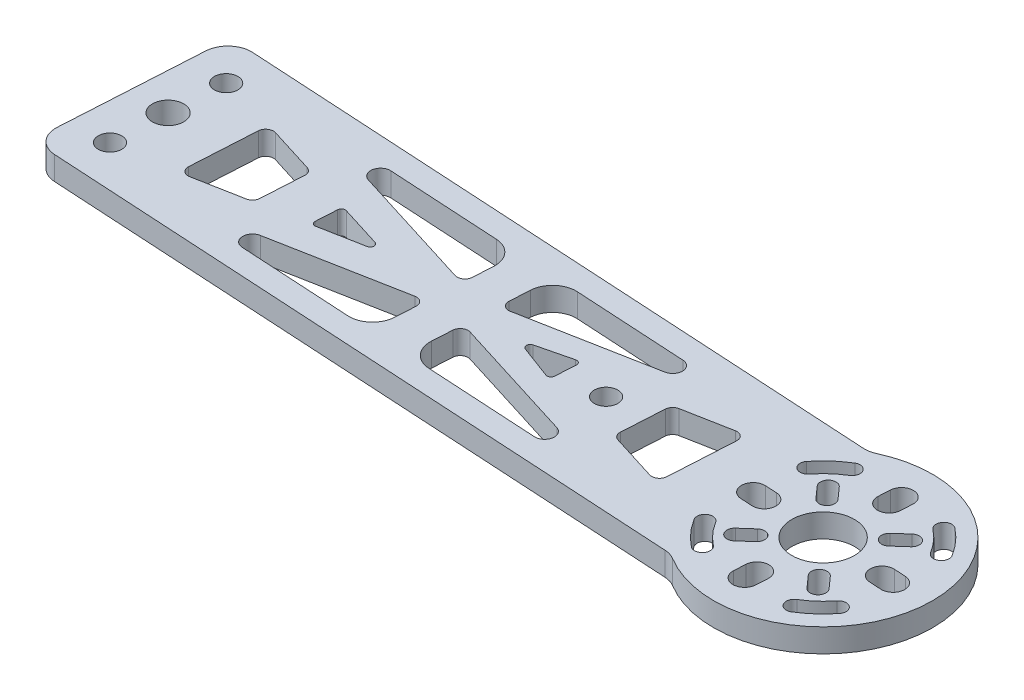
from build123d import *

# Parameters (mm, degrees)
SKETCH1_R           = 1.5
SKETCH1_R_2         = 4
SKETCH1_R_3         = 2
BOSS_EXTRUDE1_DEPTH = 3
SKETCH2_R           = 1.5
CUT_EXTRUDE2_DEPTH  = 3
FILLET1_R           = 1
FILLET2_R           = 1.25
FILLET3_R           = 3
FILLET4_R           = 1
FILLET5_R           = 0.5
FILLET6_R           = 3


with BuildPart() as part:
    # Sketch1 → Boss-Extrude1 (new body)
    with BuildSketch(Plane(origin=(0, 0, 0), x_dir=(1, 0, 0), z_dir=(0, 1, 0))):
        with BuildLine():
            Line((23.065289305, 10.113813665), (21.67993882, -13.846169724))
            Line((21.67993882, -13.846169724), (108.324128041, -18.855879772))
            ThreePointArc((108.324128041, -18.855879772), (130.192539316, -8.10025521), (109.709478525, 5.104103618))
            Line((109.709478525, 5.104103618), (23.065289305, 10.113813665))
        make_face()
        with Locations(Location((26.914085012, -9.154397921, 0), (0, 0, 270))):
            Circle(SKETCH1_R, mode=Mode.SUBTRACT)
        with Locations(Location((27.769141375, 4.847433338, 0), (0, 0, 270))):
            Circle(SKETCH1_R, mode=Mode.SUBTRACT)
        with Locations(Location((116.215882339, -7.292134094, 0), (0, 0, 270))):
            Circle(SKETCH1_R_2, mode=Mode.SUBTRACT)
        with Locations(Location((27.341613193, -2.153482292, 0), (0, 0, 270))):
            Circle(SKETCH1_R_3, mode=Mode.SUBTRACT)
    extrude(amount=BOSS_EXTRUDE1_DEPTH)

    # Sketch2 → Cut-Extrude2 (cut)
    with BuildSketch(Plane(origin=(0, 0, 0), x_dir=(1, 0, 0), z_dir=(0, 1, 0))):
        with Locations(Location((86.765069423, -5.589307457, 0), (0, 0, 270))):
            Circle(SKETCH2_R)
        Polygon((35.169248231, 2.903114787), (34.534295925, -8.078544267), (42.636402929, -6.543662479), (43.040463487, 0.444666009), align=None)
        Polygon((48.712983182, -5.392501139), (48.943874929, -1.399170574), (56.815090185, -3.857619351), align=None)
        Polygon((37.85954525, 6.253409084), (64.924303207, -2.199837199), (65.321257747, 4.665590925), align=None)
        Polygon((36.820532386, -11.716578458), (64.679199423, -6.438968493), (64.282244884, -13.304396617), align=None)
        Polygon((69.27390809, -13.593011301), (96.735620587, -15.180829461), (69.670862629, -6.727583177), align=None)
        Polygon((97.77463345, 2.789158082), (69.915966413, -2.488451884), (70.312920953, 4.376976241), align=None)
        Polygon((81.158794022, -7.268496587), (74.785077728, -4.896632215), (81.389685769, -3.275166022), align=None)
        Polygon((100.060869911, -0.848876109), (99.425917606, -11.830535163), (91.55470235, -9.372086386), (91.958762908, -2.383757897), align=None)
        with BuildLine():
            Line((120.953295402, -11.107486957), (122.283518403, -12.600975079))
            ThreePointArc((122.283518403, -12.600975079), (122.201885843, -14.01283064), (120.790030282, -13.931198079))
            Line((120.790030282, -13.931198079), (119.459807281, -12.437709958))
            ThreePointArc((119.459807281, -12.437709958), (119.541439841, -11.025854397), (120.953295402, -11.107486957))
        make_face()
        with BuildLine():
            Line((114.170015477, -16.689709781), (114.256599882, -15.192210819))
            ThreePointArc((114.256599882, -15.192210819), (115.840683249, -13.781296262), (117.251597806, -15.36537963))
            Line((117.251597806, -15.36537963), (117.165013401, -16.862878591))
            ThreePointArc((117.165013401, -16.862878591), (115.580930034, -18.273793148), (114.170015477, -16.689709781))
        make_face()
        with BuildLine():
            Line((121.361458203, -4.048209152), (122.854946324, -2.717986152))
            ThreePointArc((122.854946324, -2.717986152), (122.936578884, -1.306130591), (121.524723323, -1.22449803))
            Line((121.524723323, -1.22449803), (120.031235202, -2.554721031))
            ThreePointArc((120.031235202, -2.554721031), (119.949602642, -3.966576592), (121.361458203, -4.048209152))
        make_face()
        with BuildLine():
            Line((115.266751277, 2.278610403), (115.180166872, 0.781111441))
            ThreePointArc((115.180166872, 0.781111441), (116.591081429, -0.802971926), (118.175164796, 0.60794263))
            Line((118.175164796, 0.60794263), (118.261749201, 2.105441592))
            ThreePointArc((118.261749201, 2.105441592), (116.850834644, 3.689524959), (115.266751277, 2.278610403))
        make_face()
        with BuildLine():
            Line((112.971957397, -2.14655823), (111.641734396, -0.653070109))
            ThreePointArc((111.641734396, -0.653070109), (110.229878835, -0.571437549), (110.148246275, -1.98329311))
            Line((110.148246275, -1.98329311), (111.478469276, -3.476781231))
            ThreePointArc((111.478469276, -3.476781231), (112.890324837, -3.558413791), (112.971957397, -2.14655823))
        make_face()
        with BuildLine():
            Line((112.400529476, -12.029547157), (110.907041355, -13.359770158))
            ThreePointArc((110.907041355, -13.359770158), (109.495185794, -13.278137598), (109.576818354, -11.866282037))
            Line((109.576818354, -11.866282037), (111.070306475, -10.536059036))
            ThreePointArc((111.070306475, -10.536059036), (112.482162036, -10.617691596), (112.400529476, -12.029547157))
        make_face()
        with BuildLine():
            Line((125.786626836, -6.343003033), (124.289127874, -6.256418627))
            ThreePointArc((124.289127874, -6.256418627), (122.705044507, -7.667333184), (124.115959064, -9.251416551))
            Line((124.115959064, -9.251416551), (125.613458025, -9.338000956))
            ThreePointArc((125.613458025, -9.338000956), (127.197541393, -7.9270864), (125.786626836, -6.343003033))
        make_face()
        with BuildLine():
            Line((106.818306653, -5.246267232), (108.315805614, -5.332851638))
            ThreePointArc((108.315805614, -5.332851638), (109.726720171, -6.916935005), (108.142636804, -8.327849561))
            Line((108.142636804, -8.327849561), (106.645137842, -8.241265156))
            ThreePointArc((106.645137842, -8.241265156), (105.234223285, -6.657181789), (106.818306653, -5.246267232))
        make_face()
        with BuildLine():
            ThreePointArc((122.434928959, -17.554855914), (124.197220344, -16.253062821), (125.693448496, -14.652551185))
            ThreePointArc((125.693448496, -14.652551185), (125.517019407, -13.249385914), (124.113854136, -13.425815003))
            ThreePointArc((124.113854136, -13.425815003), (122.866997343, -14.7595747), (121.398421189, -15.844402277))
            ThreePointArc((121.398421189, -15.844402277), (121.061448255, -17.21788298), (122.434928959, -17.554855914))
        make_face()
        with BuildLine():
            ThreePointArc((123.576299429, 2.185432062), (125.176811066, 0.689203911), (126.478604158, -1.073087475))
            ThreePointArc((126.478604158, -1.073087475), (126.141631225, -2.446568178), (124.768150522, -2.109595245))
            ThreePointArc((124.768150522, -2.109595245), (123.683322945, -0.64101909), (122.349563248, 0.605837703))
            ThreePointArc((122.349563248, 0.605837703), (122.173134159, 2.009002974), (123.576299429, 2.185432062))
        make_face()
        with BuildLine():
            ThreePointArc((106.738316182, 0.068282996), (108.234544334, 1.668794633), (109.996835719, 2.970587725))
            ThreePointArc((109.996835719, 2.970587725), (111.370316423, 2.633614792), (111.033343489, 1.260134088))
            ThreePointArc((111.033343489, 1.260134088), (109.564767335, 0.175306511), (108.317910542, -1.158453186))
            ThreePointArc((108.317910542, -1.158453186), (106.914745271, -1.334882275), (106.738316182, 0.068282996))
        make_face()
        with BuildLine():
            ThreePointArc((105.95316052, -13.511180714), (107.254953612, -15.273472099), (108.855465249, -16.769700251))
            ThreePointArc((108.855465249, -16.769700251), (110.258630519, -16.593271162), (110.08220143, -15.190105892))
            ThreePointArc((110.08220143, -15.190105892), (108.748441733, -13.943249099), (107.663614156, -12.474672944))
            ThreePointArc((107.663614156, -12.474672944), (106.290133453, -12.137700011), (105.95316052, -13.511180714))
        make_face()
    extrude(amount=CUT_EXTRUDE2_DEPTH, mode=Mode.SUBTRACT)

    # Fillet1
    fillet1_edges = [part.edges().sort_by_distance(p)[0] for p in [
        (100.060869911, 1.5, 0.848876109),
        (91.958762908, 1.5, 2.383757897),
        (91.55470235, 1.5, 9.372086386),
        (99.425917606, 1.5, 11.830535163),
        (43.040463487, 1.5, -0.444666009),
        (35.169248231, 1.5, -2.903114787),
        (34.534295925, 1.5, 8.078544267),
        (42.636402929, 1.5, 6.543662479),
    ]]
    fillet(fillet1_edges, radius=FILLET1_R)

    # Fillet2
    fillet2_edges = [part.edges().sort_by_distance(p)[0] for p in [
        (97.77463345, 1.5, -2.789158082),
        (96.735620587, 1.5, 15.180829461),
        (36.820532386, 1.5, 11.716578458),
        (37.85954525, 1.5, -6.253409084),
    ]]
    fillet(fillet2_edges, radius=FILLET2_R)

    # Fillet3
    fillet3_edges = [part.edges().sort_by_distance(p)[0] for p in [
        (70.312920953, 1.5, -4.376976241),
        (69.27390809, 1.5, 13.593011301),
        (64.282244884, 1.5, 13.304396617),
        (65.321257747, 1.5, -4.665590925),
    ]]
    fillet(fillet3_edges, radius=FILLET3_R)

    # Fillet4
    fillet4_edges = [part.edges().sort_by_distance(p)[0] for p in [
        (69.915966413, 1.5, 2.488451884),
        (69.670862629, 1.5, 6.727583177),
        (64.679199423, 1.5, 6.438968493),
        (64.924303207, 1.5, 2.199837199),
    ]]
    fillet(fillet4_edges, radius=FILLET4_R)

    # Fillet5
    fillet5_edges = [part.edges().sort_by_distance(p)[0] for p in [
        (81.158794022, 1.5, 7.268496587),
        (81.389685769, 1.5, 3.275166022),
        (74.785077728, 1.5, 4.896632215),
        (48.712983182, 1.5, 5.392501139),
        (56.815090185, 1.5, 3.857619351),
        (48.943874929, 1.5, 1.399170574),
    ]]
    fillet(fillet5_edges, radius=FILLET5_R)

    # Fillet6
    fillet6_edges = [part.edges().sort_by_distance(p)[0] for p in [
        (108.324128041, 1.5, 18.855879772),
        (21.67993882, 1.5, 13.846169724),
        (23.065289305, 1.5, -10.113813665),
        (109.709478525, 1.5, -5.104103618),
    ]]
    fillet(fillet6_edges, radius=FILLET6_R)


solid = part.part
